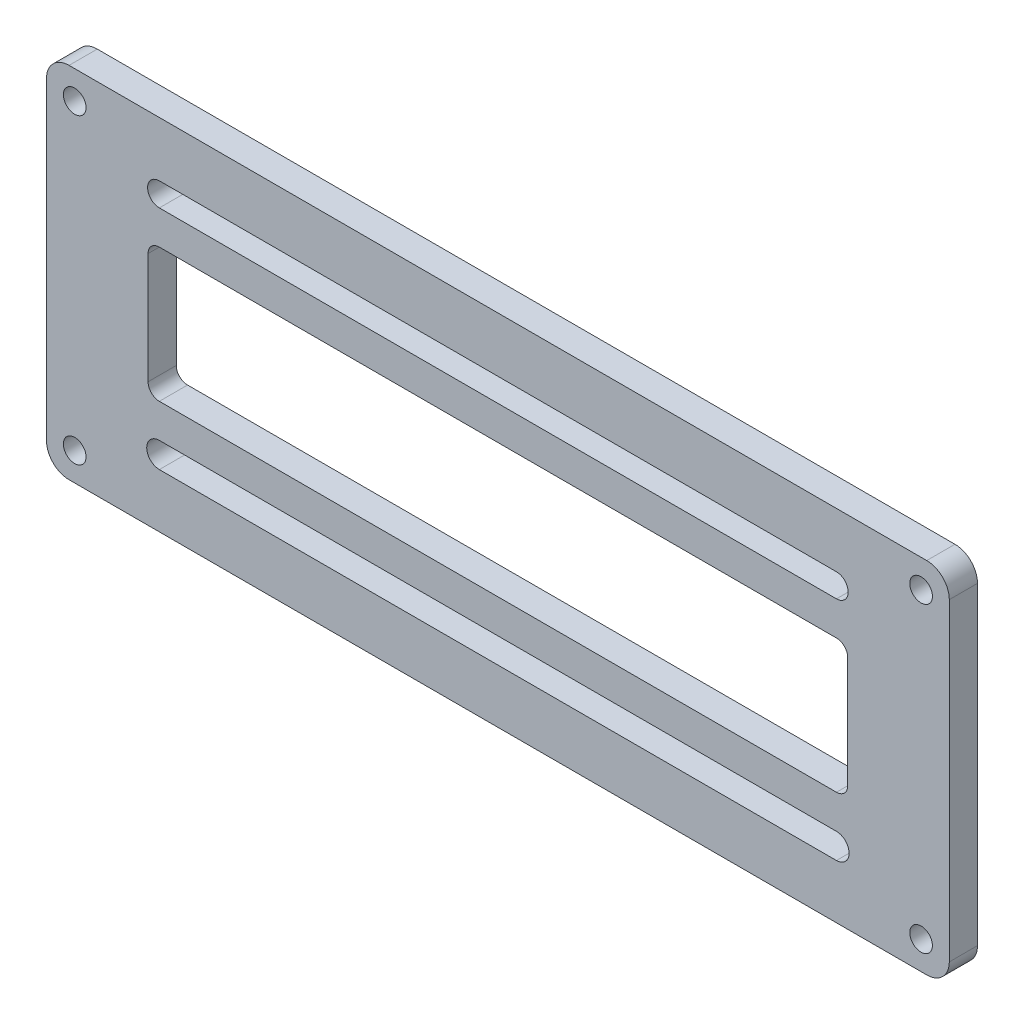
from build123d import *

# Parameters (mm, degrees)
SKETCH1_W           = 203.2
SKETCH1_H           = 80.772
BOSS_EXTRUDE1_DEPTH = 6.35
SKETCH2_R           = 2.5527
CUT_EXTRUDE1_DEPTH  = 8.89
CUT_EXTRUDE2_DEPTH  = 13.97
FILLET1_R           = 5.08


with BuildPart() as part:
    # Sketch1 → Boss-Extrude1 (new body)
    with BuildSketch(Plane.XY):
        with Locations((27.262808983, 8.108009164)):
            Rectangle(SKETCH1_W, SKETCH1_H)
    extrude(amount=BOSS_EXTRUDE1_DEPTH)

    # Sketch2 → Cut-Extrude1 (cut)
    with BuildSketch(Plane.XY.offset(6.35)):
        with Locations((-67.987191017, 42.144009164)):
            Circle(SKETCH2_R)
        with Locations((-67.987191017, -25.927990836)):
            Circle(SKETCH2_R)
        with Locations((122.512808983, 42.144009164)):
            Circle(SKETCH2_R)
        with Locations((122.512808983, -25.927990836)):
            Circle(SKETCH2_R)
    extrude(amount=-CUT_EXTRUDE1_DEPTH, mode=Mode.SUBTRACT)

    # Sketch3 → Cut-Extrude2 (cut)
    with BuildSketch(Plane.XY.offset(6.35)):
        with BuildLine():
            Line((-48.937191017, 36.147533789), (103.462808983, 36.147533789))
            ThreePointArc((103.462808983, 36.147533789), (106.102333608, 33.508009164), (103.462808983, 30.868484538))
            Line((103.462808983, 30.868484538), (-48.937191017, 30.868484538))
            ThreePointArc((-48.937191017, 30.868484538), (-51.576715642, 33.508009164), (-48.937191017, 36.147533789))
        make_face()
        with BuildLine():
            Line((-48.937191017, -14.449425855), (103.462808983, -14.449425855))
            ThreePointArc((103.462808983, -14.449425855), (106.305373964, -17.291990836), (103.462808983, -20.134555817))
            Line((103.462808983, -20.134555817), (-48.937191017, -20.134555817))
            ThreePointArc((-48.937191017, -20.134555817), (-51.779755998, -17.291990836), (-48.937191017, -14.449425855))
        make_face()
        with BuildLine():
            Line((-48.937191017, -6.829425855), (103.462808983, -6.829425855))
            ThreePointArc((103.462808983, -6.829425855), (105.258860207, -6.08547708), (106.002808983, -4.289425855))
            Line((106.002808983, -4.289425855), (106.002808983, 20.69451567))
            ThreePointArc((106.002808983, 20.69451567), (105.258860207, 22.490566894), (103.462808983, 23.23451567))
            Line((103.462808983, 23.23451567), (-48.937191017, 23.23451567))
            ThreePointArc((-48.937191017, 23.23451567), (-50.733242241, 22.490566894), (-51.477191017, 20.69451567))
            Line((-51.477191017, 20.69451567), (-51.477191017, -4.289425855))
            ThreePointArc((-51.477191017, -4.289425855), (-50.733242241, -6.08547708), (-48.937191017, -6.829425855))
        make_face()
    extrude(amount=-CUT_EXTRUDE2_DEPTH, mode=Mode.SUBTRACT)

    # Fillet1
    fillet1_edges = [part.edges().sort_by_distance(p)[0] for p in [
        (-74.337191017, 48.494009164, 3.175),
        (128.862808983, 48.494009164, 3.175),
        (128.862808983, -32.277990836, 3.175),
        (-74.337191017, -32.277990836, 3.175),
    ]]
    fillet(fillet1_edges, radius=FILLET1_R)


solid = part.part
